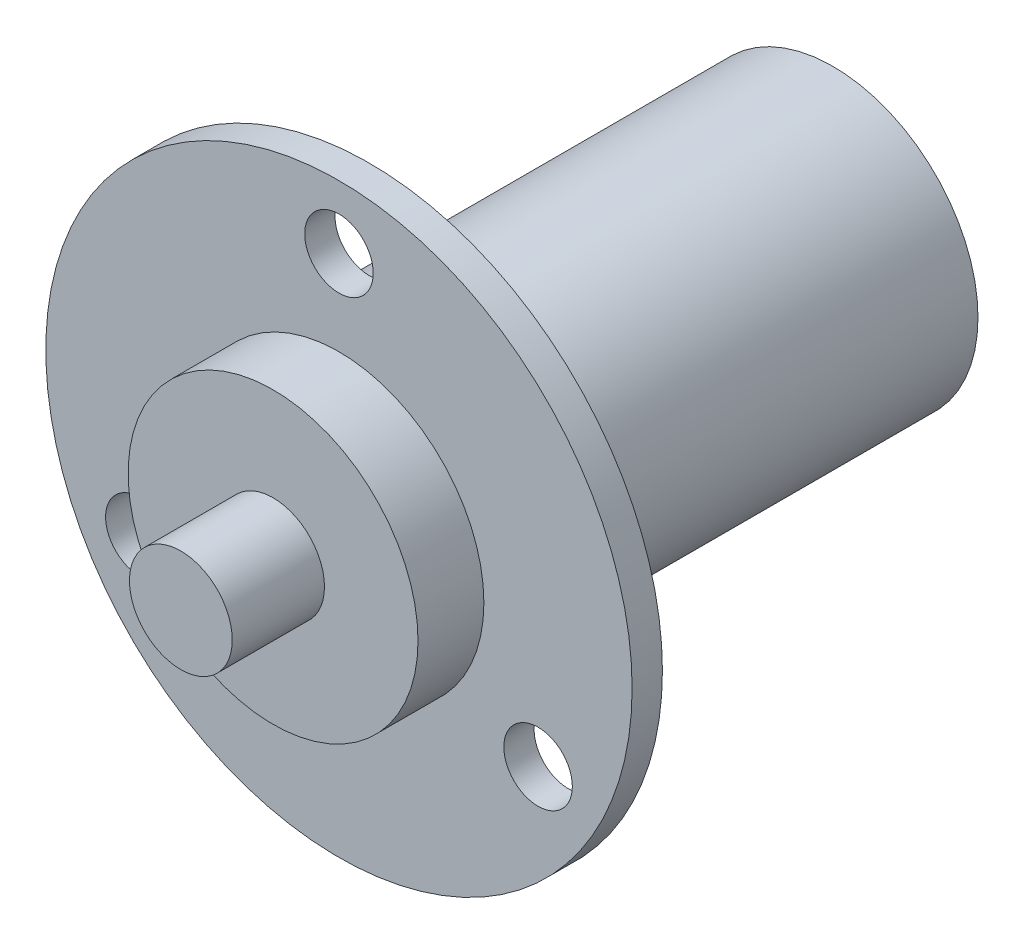
from build123d import *

# Parameters (mm, degrees)
BOSS_EXTRUDE1_DEPTH      = 5
BOSS_EXTRUDE1_DEPTH_BACK = 37.5
SKETCH1_R                = 11
SKETCH1_R_2              = 3.9
SKETCH1_3_R              = 22.25
SKETCH1_3_R_2            = 2.6
SKETCH1_3_R_3            = 11
BOSS_EXTRUDE2_DEPTH      = 2.3
BOSS_EXTRUDE4_DEPTH      = 12
BOSS_EXTRUDE4_DEPTH_BACK = 37.5
SKETCH1_4_R              = 3.9


with BuildPart() as part:
    # Sketch1 → Boss-Extrude1 (new, two sides: drawn at the far end of the back side and taken through both)
    with BuildSketch(Plane.XY.offset(-BOSS_EXTRUDE1_DEPTH_BACK)):
        Circle(SKETCH1_R)
        Circle(SKETCH1_R_2, mode=Mode.SUBTRACT)
    extrude(amount=BOSS_EXTRUDE1_DEPTH + BOSS_EXTRUDE1_DEPTH_BACK)

    # Sketch1<3> → Boss-Extrude2 (add)
    with BuildSketch(Plane.XY):
        Circle(SKETCH1_3_R)
        with Locations((-15.112143296, -8.725)):
            Circle(SKETCH1_3_R_2, mode=Mode.SUBTRACT)
        with Locations((15.112143296, -8.725)):
            Circle(SKETCH1_3_R_2, mode=Mode.SUBTRACT)
        with Locations((0, 17.45)):
            Circle(SKETCH1_3_R_2, mode=Mode.SUBTRACT)
        Circle(SKETCH1_3_R_3, mode=Mode.SUBTRACT)
    extrude(amount=-BOSS_EXTRUDE2_DEPTH)

    # Sketch1<4> → Boss-Extrude4 (add, two sides: drawn at the far end of the back side and taken through both)
    with BuildSketch(Plane.XY.offset(-BOSS_EXTRUDE4_DEPTH_BACK)):
        Circle(SKETCH1_4_R)
    extrude(amount=BOSS_EXTRUDE4_DEPTH + BOSS_EXTRUDE4_DEPTH_BACK)


solid = part.part
